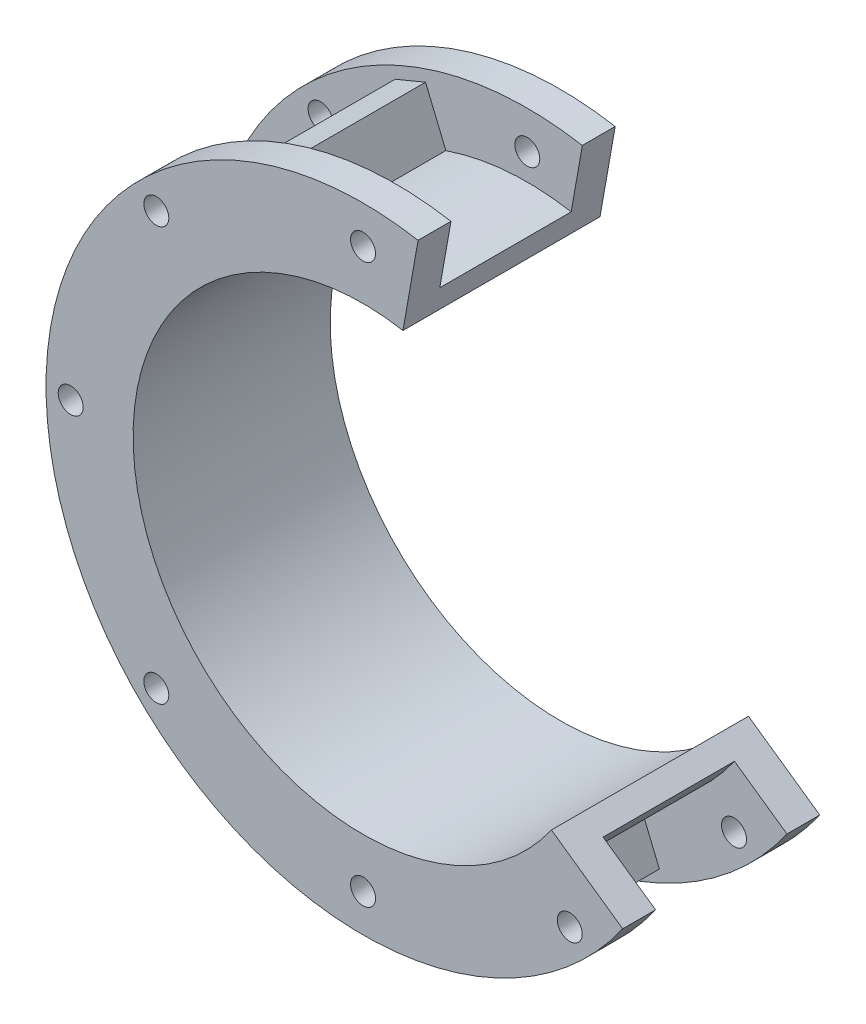
from build123d import *

# Parameters (mm, degrees)
SKETCH_1_R               = 48.25
EXTRUDE_1_DEPTH          = 30
CUT_EXTRUDE_1_DEPTH      = 75.539419102
CUT_EXTRUDE_1_DEPTH_BACK = 75.539419102
CUT_EXTRUDE_2_DEPTH      = 75.539419102
CUT_EXTRUDE_2_DEPTH_BACK = 75.539419102
CUT_EXTRUDE_3_DEPTH      = 75.539419102
CUT_EXTRUDE_3_DEPTH_BACK = 75.539419102
SKETCH_3_R               = 1.9
CUT_EXTRUDE_START        = 5
SKETCH_4_OUTSIDE_W       = 116.544
SKETCH_4_OUTSIDE_H       = 125.27
SKETCH_4_OUTSIDE_R       = 38.5
CUT_EXTRUDE_4_DEPTH      = 20
RIB_4_REACH              = 76.539
SKETCH_8_WALL_W          = 171.078838204
SKETCH_8_WALL_H          = 5
PATTERN_CIRCULAR_1_COUNT = 5
PATTERN_CIRCULAR_1_ANGLE = 180


with BuildPart() as part:
    # 草图1 → 凸台-拉伸1 (new body)
    with BuildSketch(Plane.XY):
        Circle(SKETCH_1_R)
    extrude(amount=EXTRUDE_1_DEPTH)

    # 草图2 → 切除-拉伸1 (cut, two sides: drawn at the far end of the back side and taken through both)
    with BuildSketch(Plane.XY.offset(30).offset(-CUT_EXTRUDE_1_DEPTH_BACK)):
        with BuildLine():
            Line((28.67032155, -20.075175272), (0, 0))
            Line((0, 0), (6.077686218, 34.468271355))
            ThreePointArc((6.077686218, 34.468271355), (-32.335783638, -13.393920133), (28.67032155, -20.075175272))
        make_face()
    extrude(amount=CUT_EXTRUDE_1_DEPTH + CUT_EXTRUDE_1_DEPTH_BACK, mode=Mode.SUBTRACT)

    # 草图2<3> → 切除-拉伸2 (cut, two sides: drawn at the far end of the back side and taken through both)
    with BuildSketch(Plane.XY.offset(30).offset(-CUT_EXTRUDE_2_DEPTH_BACK)):
        with BuildLine():
            Line((0, 0), (39.524086137, -27.675063054))
            ThreePointArc((39.524086137, -27.675063054), (44.577187444, 18.464475612), (8.378524572, 47.516974083))
            Line((8.378524572, 47.516974083), (0, 0))
        make_face()
    extrude(amount=CUT_EXTRUDE_2_DEPTH + CUT_EXTRUDE_2_DEPTH_BACK, mode=Mode.SUBTRACT)

    # 草图3 → 切除-拉伸3 (cut, two sides: drawn at the far end of the back side and taken through both)
    with BuildSketch(Plane.XY.offset(-CUT_EXTRUDE_3_DEPTH_BACK)):
        with Locations((31.466251763, 31.466251763)):
            Circle(SKETCH_3_R)
        with Locations((44.5, 0)):
            Circle(SKETCH_3_R)
        with Locations((31.466251763, -31.466251763)):
            Circle(SKETCH_3_R)
        with Locations((-31.466251763, -31.466251763)):
            Circle(SKETCH_3_R)
        with Locations((0, 42.5)):
            Circle(SKETCH_3_R)
        with Locations((0, -42.5)):
            Circle(SKETCH_3_R)
        with Locations((-44.5, 0)):
            Circle(SKETCH_3_R)
        with Locations((-31.466251763, 31.466251763)):
            Circle(SKETCH_3_R)
    extrude(amount=CUT_EXTRUDE_3_DEPTH + CUT_EXTRUDE_3_DEPTH_BACK, mode=Mode.SUBTRACT)

    # 草图4 outside → 切除-拉伸4 (cut)
    with BuildSketch(Plane.XY.offset(CUT_EXTRUDE_START)):
        with Locations((-4.363, 0)):
            Rectangle(SKETCH_4_OUTSIDE_W, SKETCH_4_OUTSIDE_H)
        Circle(SKETCH_4_OUTSIDE_R, mode=Mode.SUBTRACT)
    extrude(amount=CUT_EXTRUDE_4_DEPTH, mode=Mode.SUBTRACT)

    # 草图8 wall → 筋4 (add, up to next)
    with BuildSketch(Plane(origin=(17.794779605, -42.960398262, 15), x_dir=(0, 0, 1), z_dir=(0.382683432365, -0.923879532511, 0)), mode=Mode.PRIVATE) as rib_4_sk1:
        Rectangle(SKETCH_8_WALL_W, SKETCH_8_WALL_H)
    rib_4_tool1 = extrude(rib_4_sk1.sketch, amount=-RIB_4_REACH, mode=Mode.PRIVATE) - part.part
    rib_4 = rib_4_tool1.solids().sort_by_distance((17.794779605, -42.960398262, 15))[0]
    add(rib_4)

    # 阵列(圆周)1: 筋4 ×5 about axis
    pattern_circular_1_axis = Axis((0, 0, 25), (0, 0, -1))
    for i in range(1, PATTERN_CIRCULAR_1_COUNT):
        add(rib_4.rotate(pattern_circular_1_axis, i * PATTERN_CIRCULAR_1_ANGLE / (PATTERN_CIRCULAR_1_COUNT - 1)))


solid = part.part
